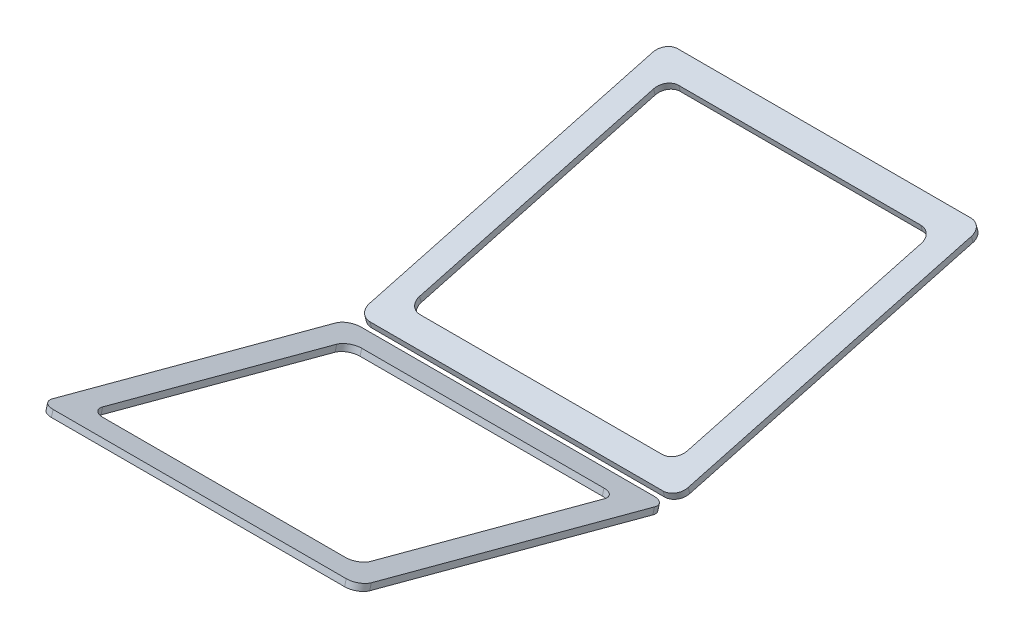
from build123d import *

# Parameters (mm, degrees)
EXTRUDE_1_DEPTH          = 0.5
MOVE_BODY_1_ANGLE        = 15
PATTERN_CIRCULAR_1_COUNT = 2


with BuildPart() as part:
    # 草图1 → 凸台-拉伸1 (new body)
    with BuildSketch(Plane(origin=(0, 0, 0), x_dir=(1, 0, 0), z_dir=(0, 1, 0))):
        with BuildLine():
            Line((-11.5, 0.5), (11.5, 0.5))
            ThreePointArc((11.5, 0.5), (12.207106781, 0.792893219), (12.5, 1.5))
            Line((12.5, 1.5), (12.5, 24.5))
            ThreePointArc((12.5, 24.5), (12.207106781, 25.207106781), (11.5, 25.5))
            Line((11.5, 25.5), (-11.5, 25.5))
            ThreePointArc((-11.5, 25.5), (-12.207106781, 25.207106781), (-12.5, 24.5))
            Line((-12.5, 24.5), (-12.5, 1.5))
            ThreePointArc((-12.5, 1.5), (-12.207106781, 0.792893219), (-11.5, 0.5))
        make_face()
        with BuildLine():
            Line((-9.5, 23.5), (9.5, 23.5))
            ThreePointArc((9.5, 23.5), (10.207106781, 23.207106781), (10.5, 22.5))
            Line((10.5, 22.5), (10.5, 3.5))
            ThreePointArc((10.5, 3.5), (10.207106781, 2.792893219), (9.5, 2.5))
            Line((9.5, 2.5), (-9.5, 2.5))
            ThreePointArc((-9.5, 2.5), (-10.207106781, 2.792893219), (-10.5, 3.5))
            Line((-10.5, 3.5), (-10.5, 22.5))
            ThreePointArc((-10.5, 22.5), (-10.207106781, 23.207106781), (-9.5, 23.5))
        make_face(mode=Mode.SUBTRACT)
    extrude(amount=EXTRUDE_1_DEPTH)


with BuildPart() as part_1:
    # Move Body 1: moved
    add(part.part.rotate(Axis((0, 0, 0), (1, 0, 0)), MOVE_BODY_1_ANGLE))


with BuildPart() as pattern_circular_1_1:
    # 阵列(圆周)1: pattern copy
    add(part_1.part.rotate(Axis((0, 0, 0), (0, 1, 0)), 1 * 360 / PATTERN_CIRCULAR_1_COUNT))


solid = Compound([part_1.part, pattern_circular_1_1.part])
